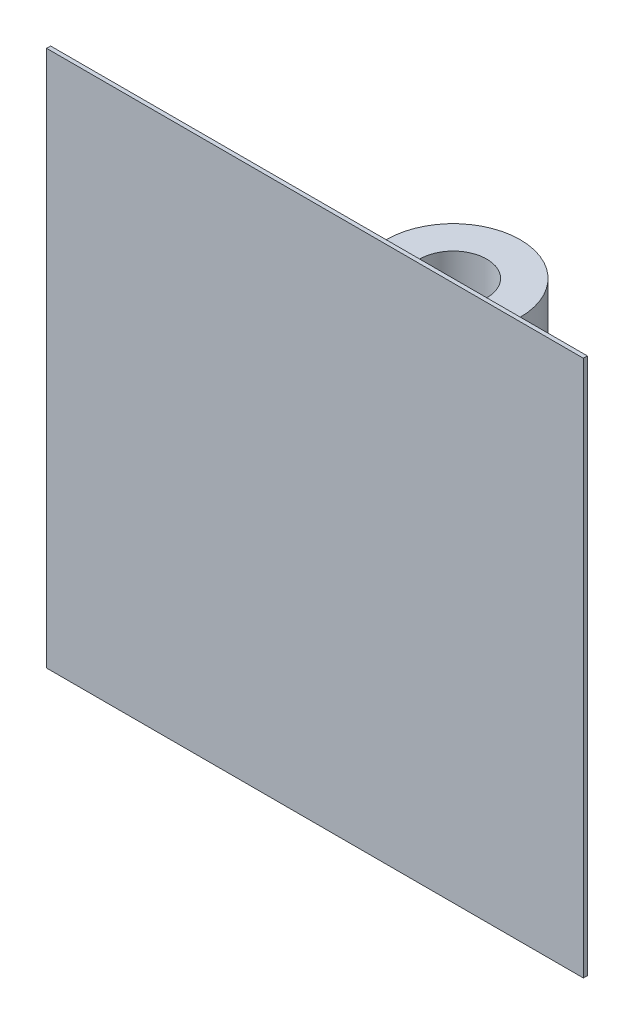
from build123d import *

# Parameters (mm, degrees)
CROQUIS1_W                   = 40
CROQUIS1_H                   = 40
SALIENTE_EXTRUIR1_DEPTH      = 0.3
SALIENTE_EXTRUIR2_DEPTH      = 10
SALIENTE_EXTRUIR2_DEPTH_BACK = 10
CROQUIS2_R                   = 2.5
CORTAR_EXTRUIR1_DEPTH        = 2.5
CORTAR_EXTRUIR1_DEPTH_BACK   = 2.5
CROQUIS3_W                   = 14.056155144
CROQUIS3_H                   = 12


with BuildPart() as part:
    # Croquis1 → Saliente-Extruir1 (new body)
    with BuildSketch(Plane.XY):
        Rectangle(CROQUIS1_W, CROQUIS1_H)
    extrude(amount=SALIENTE_EXTRUIR1_DEPTH)

    # Croquis2 → Saliente-Extruir2 (add, two sides: drawn at the far end of the back side and taken through both)
    with BuildSketch(Plane(origin=(0, 0, 0), x_dir=(1, 0, 0), z_dir=(0, 1, 0)).offset(-SALIENTE_EXTRUIR2_DEPTH_BACK)):
        with BuildLine():
            Line((-5, 10), (-5, 0))
            Line((-5, 0), (5, 0))
            Line((5, 0), (5, 10))
            ThreePointArc((5, 10), (0, 15), (-5, 10))
        make_face()
        with Locations(Location((0, 10, 0), (0, 0, 270))):
            Circle(CROQUIS2_R, mode=Mode.SUBTRACT)
    extrude(amount=SALIENTE_EXTRUIR2_DEPTH + SALIENTE_EXTRUIR2_DEPTH_BACK)

    # Croquis3 → Cortar-Extruir1 (cut, two sides: drawn at the far end of the back side and taken through both)
    with BuildSketch(Plane(origin=(0, 0, 0), x_dir=(1, 0, 0), z_dir=(0, 1, 0)).offset(-CORTAR_EXTRUIR1_DEPTH_BACK)):
        with Locations((0, 10)):
            Rectangle(CROQUIS3_W, CROQUIS3_H)
    extrude(amount=CORTAR_EXTRUIR1_DEPTH + CORTAR_EXTRUIR1_DEPTH_BACK, mode=Mode.SUBTRACT)


solid = part.part
